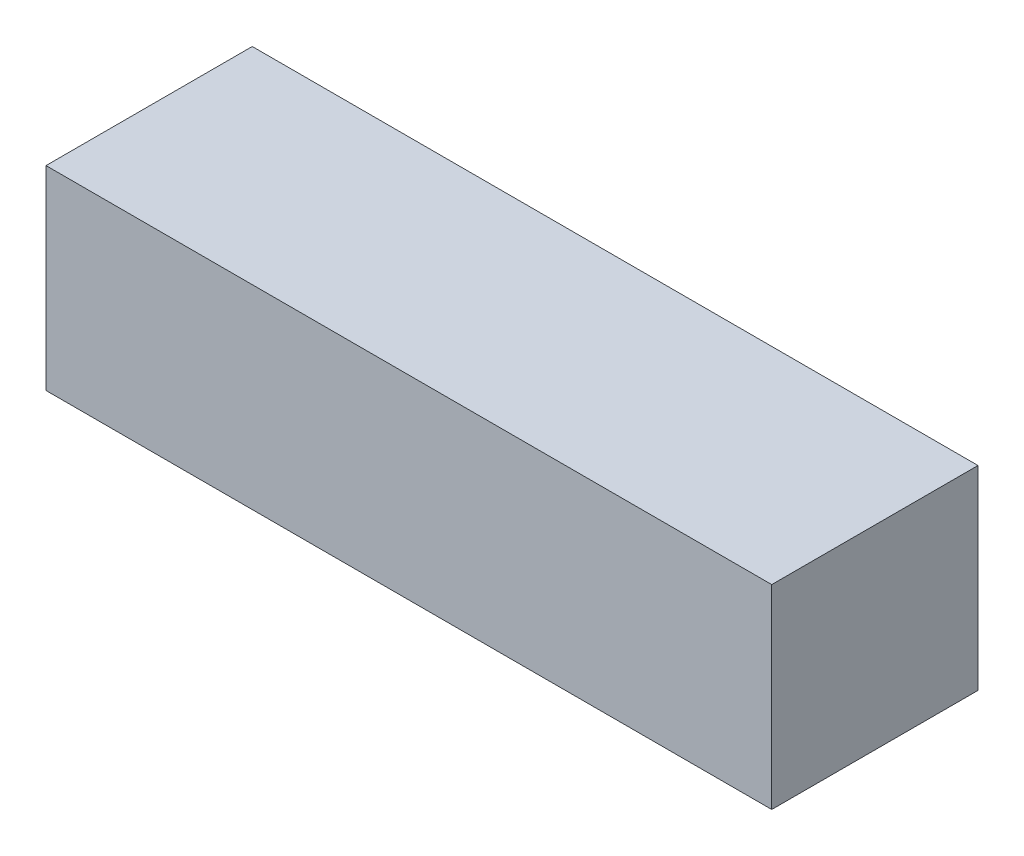
from build123d import *

# Parameters (mm, degrees)
SKETCH1_W           = 19
SKETCH1_H           = 5.4
BOSS_EXTRUDE1_DEPTH = 5.1


with BuildPart() as part:
    # Sketch1 → Boss-Extrude1 (new body)
    with BuildSketch(Plane(origin=(0, 0, 0), x_dir=(1, 0, 0), z_dir=(0, 1, 0))):
        Rectangle(SKETCH1_W, SKETCH1_H)
    extrude(amount=BOSS_EXTRUDE1_DEPTH)


solid = part.part
